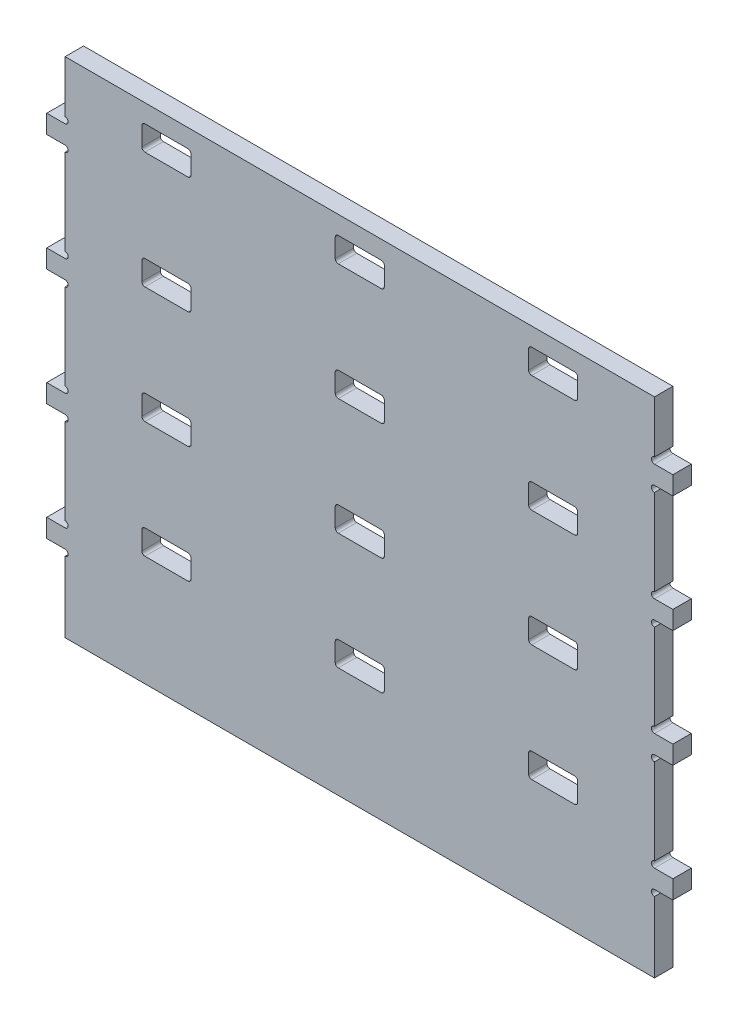
from build123d import *

# Parameters (mm, degrees)
BOSS_EXTRUDE1_DEPTH     = 19.05
SKETCH3_W               = 50.8
SKETCH3_H               = 25.4
CUT_EXTRUDE2_DEPTH      = 985.608197724
SKETCH4_W               = 609.6
SKETCH4_H               = 12.7
CUT_EXTRUDE3_DEPTH      = 985.608197724
CUT_EXTRUDE4_DEPTH      = 985.608197724
CUT_EXTRUDE4_DEPTH_BACK = 985.608197724
SKETCH5_W               = 533.4
SKETCH5_H               = 224.282
CUT_EXTRUDE5_DEPTH      = 985.608197724
CUT_EXTRUDE5_DEPTH_BACK = 985.608197724
SKETCH6_W               = 1348.924846149
SKETCH6_H               = 423.84329992
FILLET1_R               = 3.175


with BuildPart() as part:
    # Sketch1 → Boss-Extrude1 (new body)
    with BuildSketch(Plane.XY):
        with BuildLine():
            Line((0, 0), (0, 85.725))
            ThreePointArc((0, 85.725), (3.175, 88.9), (0, 92.075))
            Line((0, 92.075), (-19.05, 92.075))
            Line((-19.05, 92.075), (-19.05, 111.125))
            Line((-19.05, 111.125), (0, 111.125))
            ThreePointArc((0, 111.125), (3.175, 114.3), (0, 117.475))
            Line((0, 117.475), (0, 206.375))
            ThreePointArc((0, 206.375), (3.175, 209.55), (0, 212.725))
            Line((0, 212.725), (-19.05, 212.725))
            Line((-19.05, 212.725), (-19.05, 231.775))
            Line((-19.05, 231.775), (0, 231.775))
            ThreePointArc((0, 231.775), (3.175, 234.95), (0, 238.125))
            Line((0, 238.125), (0, 327.025))
            ThreePointArc((0, 327.025), (3.175, 330.2), (0, 333.375))
            Line((0, 333.375), (-19.05, 333.375))
            Line((-19.05, 333.375), (-19.05, 352.425))
            Line((-19.05, 352.425), (0, 352.425))
            ThreePointArc((0, 352.425), (3.175, 355.6), (0, 358.775))
            Line((0, 358.775), (0, 447.675))
            ThreePointArc((0, 447.675), (3.175, 450.85), (0, 454.025))
            Line((0, 454.025), (-19.05, 454.025))
            Line((-19.05, 454.025), (-19.05, 473.075))
            Line((-19.05, 473.075), (0, 473.075))
            ThreePointArc((0, 473.075), (3.175, 476.25), (0, 479.425))
            Line((0, 479.425), (0, 568.325))
            ThreePointArc((0, 568.325), (3.175, 571.5), (0, 574.675))
            Line((0, 574.675), (-19.05, 574.675))
            Line((-19.05, 574.675), (-19.05, 593.725))
            Line((-19.05, 593.725), (0, 593.725))
            ThreePointArc((0, 593.725), (3.175, 596.9), (0, 600.075))
            Line((0, 600.075), (0, 688.975))
            ThreePointArc((0, 688.975), (3.175, 692.15), (0, 695.325))
            Line((0, 695.325), (-19.05, 695.325))
            Line((-19.05, 695.325), (-19.05, 714.375))
            Line((-19.05, 714.375), (0, 714.375))
            ThreePointArc((0, 714.375), (3.175, 717.55), (0, 720.725))
            Line((0, 720.725), (0, 757.555))
            Line((0, 757.555), (609.6, 757.555))
            Line((609.6, 757.555), (609.6, 720.725))
            ThreePointArc((609.6, 720.725), (606.425, 717.55), (609.6, 714.375))
            Line((609.6, 714.375), (628.65, 714.375))
            Line((628.65, 714.375), (628.65, 695.325))
            Line((628.65, 695.325), (609.6, 695.325))
            ThreePointArc((609.6, 695.325), (606.425, 692.15), (609.6, 688.975))
            Line((609.6, 688.975), (609.6, 600.075))
            ThreePointArc((609.6, 600.075), (606.425, 596.9), (609.6, 593.725))
            Line((609.6, 593.725), (628.65, 593.725))
            Line((628.65, 593.725), (628.65, 574.675))
            Line((628.65, 574.675), (609.6, 574.675))
            ThreePointArc((609.6, 574.675), (606.425, 571.5), (609.6, 568.325))
            Line((609.6, 568.325), (609.6, 479.425))
            ThreePointArc((609.6, 479.425), (606.425, 476.25), (609.6, 473.075))
            Line((609.6, 473.075), (628.65, 473.075))
            Line((628.65, 473.075), (628.65, 454.025))
            Line((628.65, 454.025), (609.6, 454.025))
            ThreePointArc((609.6, 454.025), (606.425, 450.85), (609.6, 447.675))
            Line((609.6, 447.675), (609.6, 358.775))
            ThreePointArc((609.6, 358.775), (606.425, 355.6), (609.6, 352.425))
            Line((609.6, 352.425), (628.65, 352.425))
            Line((628.65, 352.425), (628.65, 333.375))
            Line((628.65, 333.375), (609.6, 333.375))
            ThreePointArc((609.6, 333.375), (606.425, 330.2), (609.6, 327.025))
            Line((609.6, 327.025), (609.6, 238.125))
            ThreePointArc((609.6, 238.125), (606.425, 234.95), (609.6, 231.775))
            Line((609.6, 231.775), (628.65, 231.775))
            Line((628.65, 231.775), (628.65, 212.725))
            Line((628.65, 212.725), (609.6, 212.725))
            ThreePointArc((609.6, 212.725), (606.425, 209.55), (609.6, 206.375))
            Line((609.6, 206.375), (609.6, 117.475))
            ThreePointArc((609.6, 117.475), (606.425, 114.3), (609.6, 111.125))
            Line((609.6, 111.125), (628.65, 111.125))
            Line((628.65, 111.125), (628.65, 92.075))
            Line((628.65, 92.075), (609.6, 92.075))
            ThreePointArc((609.6, 92.075), (606.425, 88.9), (609.6, 85.725))
            Line((609.6, 85.725), (609.6, 0))
            Line((609.6, 0), (0, 0))
        make_face()
    extrude(amount=BOSS_EXTRUDE1_DEPTH)

    # Sketch3 → Cut-Extrude2 (cut, through all)
    with BuildSketch(Plane.XY.offset(19.05)):
        with Locations((104.775, 139.7)):
            Rectangle(SKETCH3_W, SKETCH3_H)
        with Locations((104.775, 260.35)):
            Rectangle(SKETCH3_W, SKETCH3_H)
        with Locations((504.825, 139.7)):
            Rectangle(SKETCH3_W, SKETCH3_H)
        with Locations((304.8, 139.7)):
            Rectangle(SKETCH3_W, SKETCH3_H)
        with Locations((504.825, 260.35)):
            Rectangle(SKETCH3_W, SKETCH3_H)
        with Locations((304.8, 260.35)):
            Rectangle(SKETCH3_W, SKETCH3_H)
        with Locations((104.775, 381)):
            Rectangle(SKETCH3_W, SKETCH3_H)
        with Locations((504.825, 381)):
            Rectangle(SKETCH3_W, SKETCH3_H)
        with Locations((304.8, 381)):
            Rectangle(SKETCH3_W, SKETCH3_H)
        with Locations((104.775, 501.65)):
            Rectangle(SKETCH3_W, SKETCH3_H)
        with Locations((504.825, 501.65)):
            Rectangle(SKETCH3_W, SKETCH3_H)
        with Locations((304.8, 501.65)):
            Rectangle(SKETCH3_W, SKETCH3_H)
    extrude(amount=-CUT_EXTRUDE2_DEPTH, mode=Mode.SUBTRACT)

    # Sketch4 → Cut-Extrude3 (cut, through all)
    with BuildSketch(Plane.XY.offset(19.05)):
        with Locations((304.8, 6.35)):
            Rectangle(SKETCH4_W, SKETCH4_H)
    extrude(amount=-CUT_EXTRUDE3_DEPTH, mode=Mode.SUBTRACT)

    # Sketch5 → Cut-Extrude4 (cut, two sides: drawn at the far end of the back side and taken through both)
    with BuildSketch(Plane.XY.offset(19.05).offset(-CUT_EXTRUDE4_DEPTH_BACK)):
        with Locations((304.8, 645.414)):
            Rectangle(SKETCH5_W, SKETCH5_H)
    extrude(amount=CUT_EXTRUDE4_DEPTH + CUT_EXTRUDE4_DEPTH_BACK, mode=Mode.SUBTRACT)

    # Sketch6 → Cut-Extrude5 (cut, two sides: drawn at the far end of the back side and taken through both)
    with BuildSketch(Plane.XY.offset(19.05).offset(-CUT_EXTRUDE5_DEPTH_BACK)):
        with Locations((467.467327316, 745.19464996)):
            Rectangle(SKETCH6_W, SKETCH6_H)
    extrude(amount=CUT_EXTRUDE5_DEPTH + CUT_EXTRUDE5_DEPTH_BACK, mode=Mode.SUBTRACT)

    # Fillet1
    fillet1_edges = [part.edges().sort_by_distance(p)[0] for p in [
        (130.175, 152.4, 9.525),
        (130.175, 127, 9.525),
        (79.375, 127, 9.525),
        (79.375, 152.4, 9.525),
        (479.425, 514.35, 9.525),
        (530.225, 514.35, 9.525),
        (530.225, 488.95, 9.525),
        (479.425, 488.95, 9.525),
        (279.4, 488.95, 9.525),
        (279.4, 514.35, 9.525),
        (330.2, 514.35, 9.525),
        (330.2, 488.95, 9.525),
        (279.4, 368.3, 9.525),
        (279.4, 393.7, 9.525),
        (330.2, 393.7, 9.525),
        (330.2, 368.3, 9.525),
        (279.4, 247.65, 9.525),
        (279.4, 273.05, 9.525),
        (330.2, 273.05, 9.525),
        (330.2, 247.65, 9.525),
        (279.4, 127, 9.525),
        (279.4, 152.4, 9.525),
        (330.2, 152.4, 9.525),
        (330.2, 127, 9.525),
        (479.425, 393.7, 9.525),
        (530.225, 393.7, 9.525),
        (530.225, 368.3, 9.525),
        (479.425, 368.3, 9.525),
        (479.425, 273.05, 9.525),
        (530.225, 273.05, 9.525),
        (530.225, 247.65, 9.525),
        (479.425, 247.65, 9.525),
        (479.425, 152.4, 9.525),
        (530.225, 152.4, 9.525),
        (530.225, 127, 9.525),
        (479.425, 127, 9.525),
        (79.375, 488.95, 9.525),
        (130.175, 514.35, 9.525),
        (130.175, 488.95, 9.525),
        (79.375, 368.3, 9.525),
        (79.375, 393.7, 9.525),
        (130.175, 393.7, 9.525),
        (130.175, 368.3, 9.525),
        (79.375, 247.65, 9.525),
        (79.375, 273.05, 9.525),
        (130.175, 273.05, 9.525),
        (130.175, 247.65, 9.525),
        (79.375, 514.35, 9.525),
    ]]
    fillet(fillet1_edges, radius=FILLET1_R)


solid = part.part
